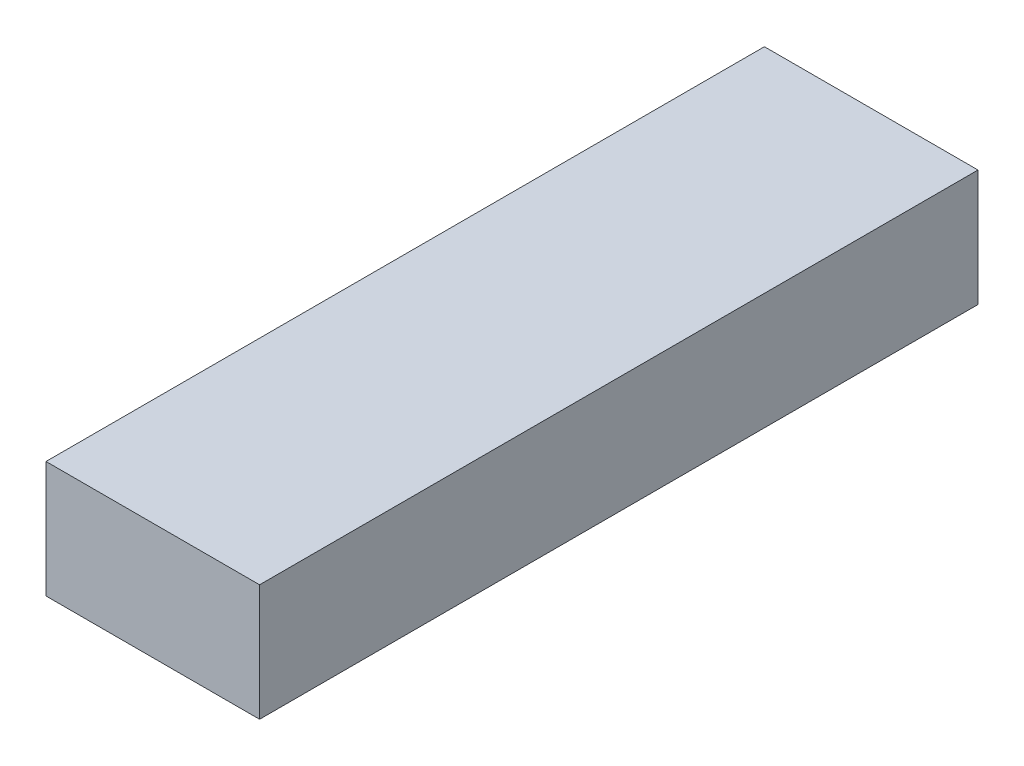
from build123d import *

# Parameters (mm, degrees)
SKETCH2_W           = 69.85
SKETCH2_H           = 234.95
BOSS_EXTRUDE1_DEPTH = 38.1


with BuildPart() as part:
    # Sketch2 → Boss-Extrude1 (new body)
    with BuildSketch(Plane(origin=(0, 0, 0), x_dir=(1, 0, 0), z_dir=(0, 1, 0))):
        with Locations((-49.467008407, 11.7475)):
            Rectangle(SKETCH2_W, SKETCH2_H)
    extrude(amount=BOSS_EXTRUDE1_DEPTH)


solid = part.part
